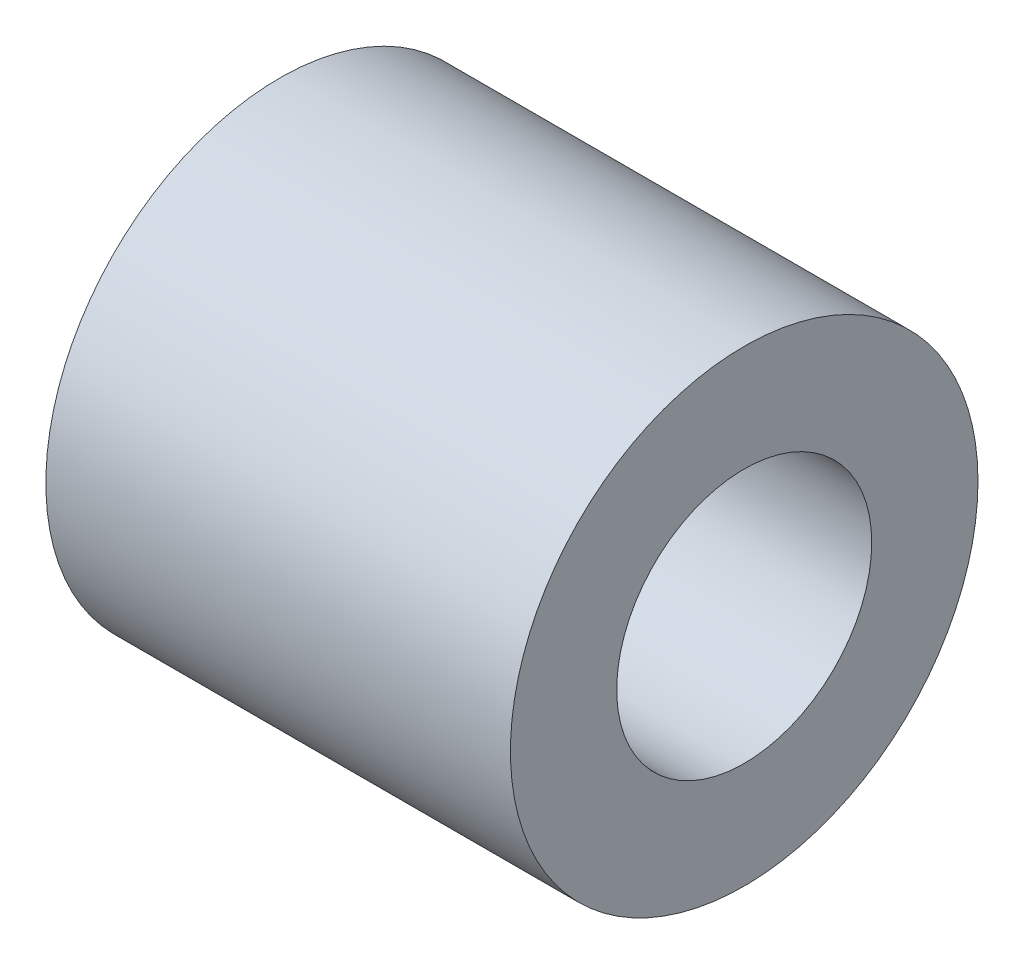
from build123d import *

# Parameters (mm, degrees)
SKETCH_1_R      = 5.5
SKETCH_1_R_2    = 3
EXTRUDE_1_DEPTH = 10.93


with BuildPart() as part:
    # 草图1 → 凸台-拉伸1 (new body)
    with BuildSketch(Plane(origin=(0, 0, 0), x_dir=(0, 0, -1), z_dir=(1, 0, 0))):
        Circle(SKETCH_1_R)
        Circle(SKETCH_1_R_2, mode=Mode.SUBTRACT)
    extrude(amount=EXTRUDE_1_DEPTH)


solid = part.part
